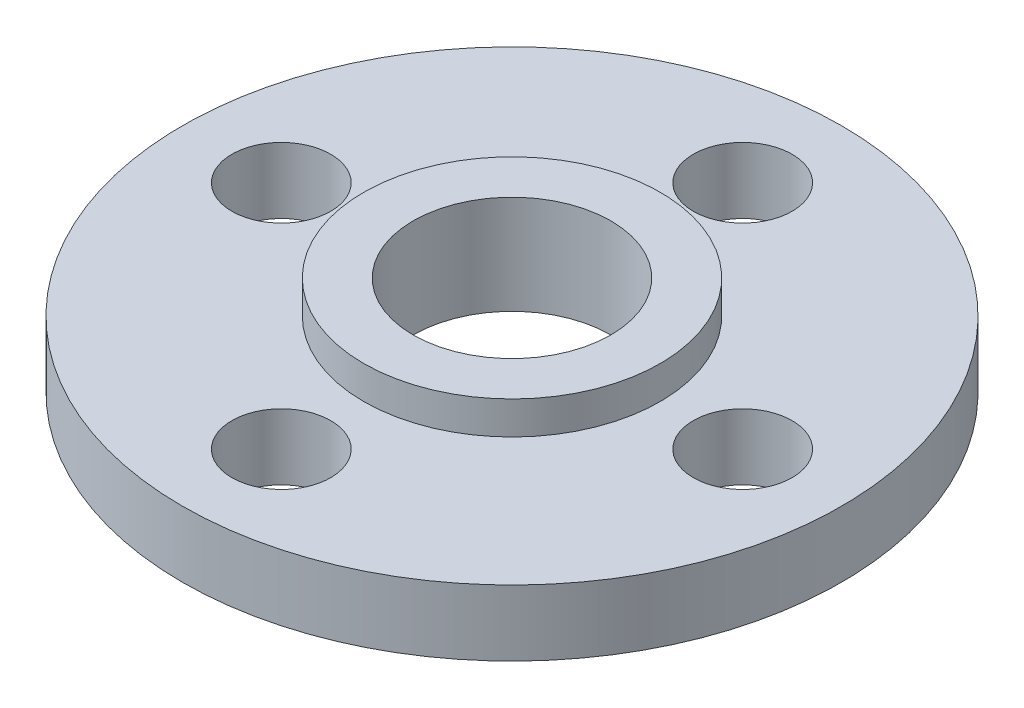
from build123d import *

# Parameters (mm, degrees)
SKETCH_1_R          = 10
EXTRUDE_1_DEPTH     = 2
SKETCH_2_R          = 3
SKETCH_2_R_2        = 1.5
CUT_EXTRUDE_1_DEPTH = 2
EXTRUDE_START       = 1
SKETCH_3_R          = 4.5
SKETCH_3_R_2        = 3
EXTRUDE_2_DEPTH     = 1


with BuildPart() as part:
    # 草图1 → 凸台-拉伸1 (new body)
    with BuildSketch(Plane(origin=(0, 0, 0), x_dir=(1, 0, 0), z_dir=(0, 1, 0))):
        with Locations(Location((0, 0, 0), (0, 0, 270))):
            Circle(SKETCH_1_R)
    extrude(amount=EXTRUDE_1_DEPTH)

    # 草图2 → 切除-拉伸1 (cut)
    with BuildSketch(Plane(origin=(0, 2, 0), x_dir=(1, 0, 0), z_dir=(0, 1, 0))):
        with Locations(Location((0, 0, 0), (0, 0, 270))):
            Circle(SKETCH_2_R)
        with Locations(Location((0, 7, 0), (0, 0, 270))):
            Circle(SKETCH_2_R_2)
        with Locations(Location((7, 0, 0), (0, 0, 270))):
            Circle(SKETCH_2_R_2)
        with Locations(Location((0, -7, 0), (0, 0, 270))):
            Circle(SKETCH_2_R_2)
        with Locations(Location((-7, 0, 0), (0, 0, 270))):
            Circle(SKETCH_2_R_2)
    extrude(amount=-CUT_EXTRUDE_1_DEPTH, mode=Mode.SUBTRACT)

    # 草图3 → 凸台-拉伸2 (add)
    with BuildSketch(Plane(origin=(0, 2, 0), x_dir=(1, 0, 0), z_dir=(0, 1, 0)).offset(EXTRUDE_START)):
        with Locations(Location((0, 0, 0), (0, 0, 270))):
            Circle(SKETCH_3_R)
        with Locations(Location((0, 0, 0), (0, 0, 270))):
            Circle(SKETCH_3_R_2, mode=Mode.SUBTRACT)
    extrude(amount=-EXTRUDE_2_DEPTH)


solid = part.part
